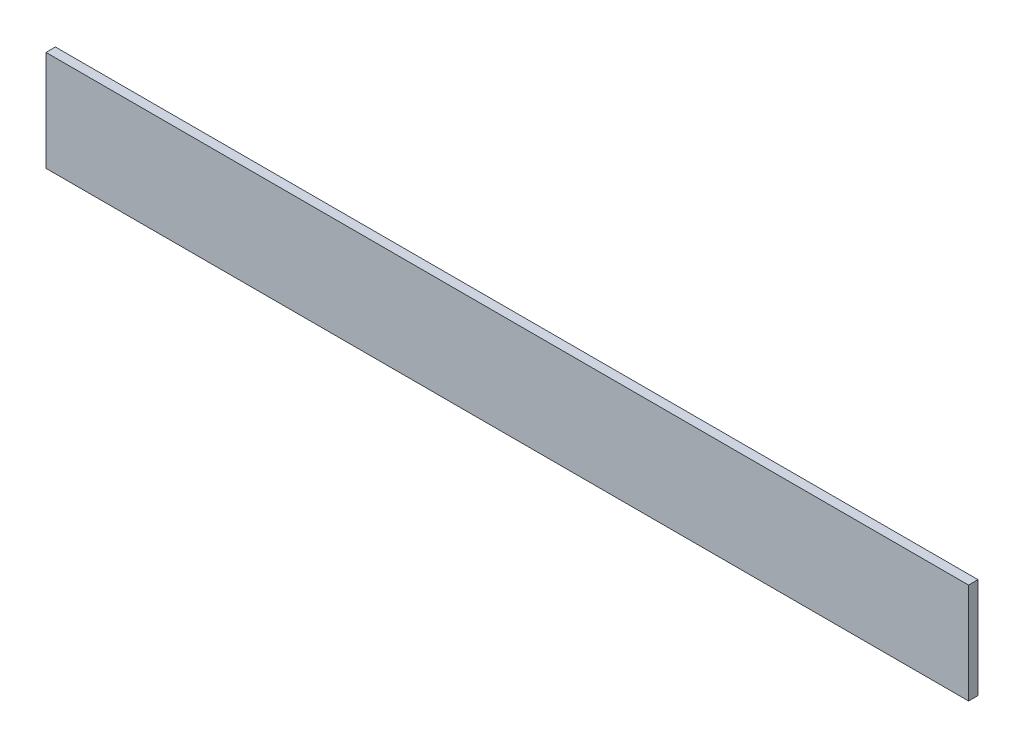
from build123d import *

# Parameters (mm, degrees)
SKETCH_1_W      = 294
SKETCH_1_H      = 32
EXTRUDE_1_DEPTH = 1.5


with BuildPart() as part:
    # 草图1 → 凸台-拉伸1 (new, symmetric)
    with BuildSketch(Plane.XY):
        Rectangle(SKETCH_1_W, SKETCH_1_H)
    extrude(amount=EXTRUDE_1_DEPTH, both=True)


solid = part.part
